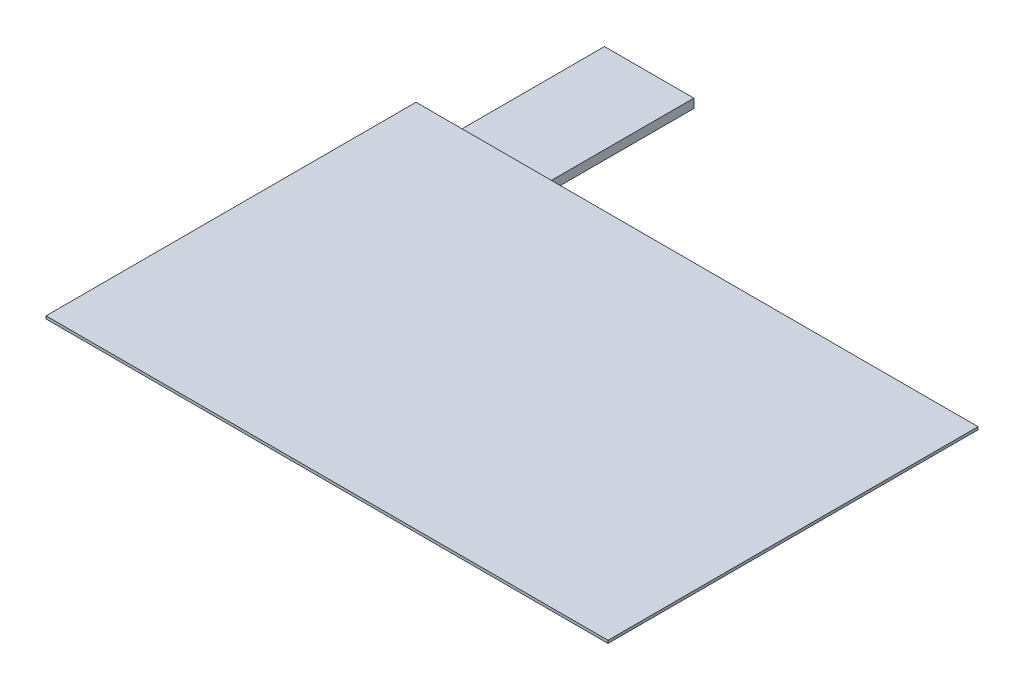
from build123d import *

# Parameters (mm, degrees)
SKETCH1_W           = 255.5875
SKETCH1_H           = 168.275
BOSS_EXTRUDE1_DEPTH = 1.2446
SKETCH2_W           = 228.6
SKETCH2_H           = 136.525
BOSS_EXTRUDE2_DEPTH = 4.0894
SKETCH3_W           = 40.64
SKETCH3_H           = 81.915
CABLE_DEPTH         = 4.0894


with BuildPart() as part:
    # Sketch1 → Boss-Extrude1 (new body)
    with BuildSketch(Plane(origin=(0, 0, 0), x_dir=(1, 0, 0), z_dir=(0, 1, 0))):
        Rectangle(SKETCH1_W, SKETCH1_H)
    extrude(amount=BOSS_EXTRUDE1_DEPTH)

    # Sketch2 → Boss-Extrude2 (add)
    with BuildSketch(Plane.XZ):
        Rectangle(SKETCH2_W, SKETCH2_H)
    extrude(amount=BOSS_EXTRUDE2_DEPTH)


with BuildPart() as body_2:
    # Sketch3 → Cable (new body)
    with BuildSketch(Plane.XZ.offset(4.0894)):
        with Locations((-87.78875, -109.22)):
            Rectangle(SKETCH3_W, SKETCH3_H)
    extrude(amount=-CABLE_DEPTH)


solid = Compound([part.part, body_2.part])
